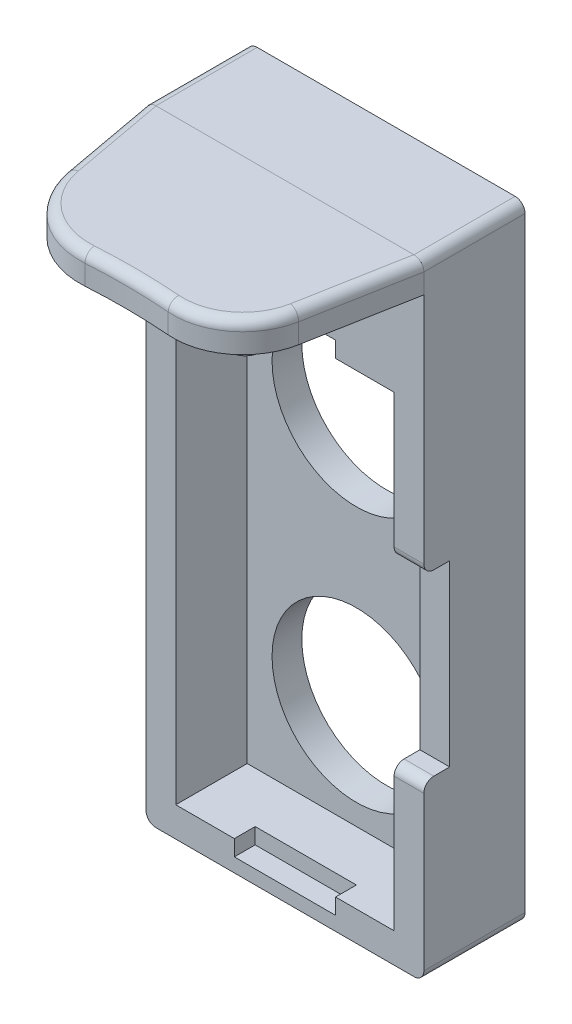
from build123d import *

# Parameters (mm, degrees)
SKETCH2_W           = 28
SKETCH2_H           = 53
SKETCH2_W_2         = 22
SKETCH2_H_2         = 47
SKETCH2_R           = 8.5
BOSS_EXTRUDE1_DEPTH = 3
SKETCH3_W           = 28
SKETCH3_H           = 53
SKETCH3_W_2         = 22
SKETCH3_H_2         = 47
EXTRUDE_THIN1_DEPTH = 7.2
SKETCH4_W           = 6
SKETCH4_H           = 18
CUT_EXTRUDE1_DEPTH  = 2.6
SKETCH5_W           = 10.2
SKETCH5_H           = 1.6
CUT_EXTRUDE2_DEPTH  = 2.1
SKETCH6_W           = 28
SKETCH6_H           = 10.2
BOSS_EXTRUDE2_DEPTH = 10
SKETCH7_R           = 1.5875
BOSS_EXTRUDE3_DEPTH = 3
SKETCH8_R           = 1.5875
BOSS_EXTRUDE4_DEPTH = 3.2
FILLET1_R           = 8
FILLET2_R           = 7
FILLET3_R           = 1
FILLET4_R           = 1


with BuildPart() as part:
    # Sketch2 → Boss-Extrude1 (new body)
    # profile 1 of 2: a face of its own
    with BuildSketch(Plane.XY):
        Rectangle(SKETCH2_W, SKETCH2_H)
        Rectangle(SKETCH2_W_2, SKETCH2_H_2, mode=Mode.SUBTRACT)
    # profile 2 of 2: a face of its own
    with BuildSketch(Plane.XY):
        Rectangle(SKETCH2_W_2, SKETCH2_H_2)
        with Locations((0, 12.9)):
            Circle(SKETCH2_R, mode=Mode.SUBTRACT)
        with Locations((0, -12.9)):
            Circle(SKETCH2_R, mode=Mode.SUBTRACT)
    extrude(amount=BOSS_EXTRUDE1_DEPTH)

    # Sketch3 → Extrude-Thin1 (add)
    with BuildSketch(Plane.XY.offset(3)):
        Rectangle(SKETCH3_W, SKETCH3_H)
        Rectangle(SKETCH3_W_2, SKETCH3_H_2, mode=Mode.SUBTRACT)
    extrude(amount=EXTRUDE_THIN1_DEPTH)

    # Sketch4 → Cut-Extrude1 (cut)
    with BuildSketch(Plane.XY.offset(10.2)):
        with Locations((11, 0)):
            Rectangle(SKETCH4_W, SKETCH4_H)
    extrude(amount=-CUT_EXTRUDE1_DEPTH, mode=Mode.SUBTRACT)

    # Sketch5 → Cut-Extrude2 (cut)
    with BuildSketch(Plane.XY.offset(10.2)):
        with Locations((0, 24.3)):
            Rectangle(SKETCH5_W, SKETCH5_H)
        with Locations((0, -24.3)):
            Rectangle(SKETCH5_W, SKETCH5_H)
    extrude(amount=-CUT_EXTRUDE2_DEPTH, mode=Mode.SUBTRACT)

    # Sketch6 → Boss-Extrude2 (add)
    with BuildSketch(Plane(origin=(0, 26.5, 0), x_dir=(1, 0, 0), z_dir=(0, 1, 0))):
        with Locations((0, -5.1)):
            Rectangle(SKETCH6_W, SKETCH6_H)
    extrude(amount=BOSS_EXTRUDE2_DEPTH)

    # Fillet4
    fillet4_edges = [part.edges().sort_by_distance(p)[0] for p in [
        (-14, -26.5, 5.1),
        (14, -26.5, 5.1),
        (12.5, 9, 10.2),
        (12.5, -9, 10.2),
        (-14, 36.5, 5.1),
        (14, 36.5, 5.1),
    ]]
    fillet(fillet4_edges, radius=FILLET4_R)


with BuildPart() as body_2:
    # Sketch7 → Boss-Extrude3 (new body)
    # profile 1 of 11: a face of its own
    with BuildSketch(Plane(origin=(0, 36.5, 0), x_dir=(1, 0, 0), z_dir=(0, 1, 0))):
        with BuildLine():
            ThreePointArc((-13.769529259, -11.454419317), (-6.913275343, -10.514252827), (0, -10.2))
            Line((0, -10.2), (-14, -10.2))
            Line((-14, -10.2), (-13.769529259, -11.454419317))
        make_face()
    # profile 2 of 11: a face of its own
    with BuildSketch(Plane(origin=(0, 36.5, 0), x_dir=(1, 0, 0), z_dir=(0, 1, 0))):
        with BuildLine():
            Line((0, -20.2), (0, -10.2))
            ThreePointArc((0, -10.2), (-6.913275343, -10.514252827), (-13.769529259, -11.454419317))
            Line((-13.769529259, -11.454419317), (-10.842149023, -27.387731745))
            ThreePointArc((-10.842149023, -27.387731745), (-5.443523892, -26.647443171), (0, -26.4))
            Line((0, -26.4), (0, -20.2))
        make_face()
        with Locations((-6, -20.2)):
            Circle(SKETCH7_R, mode=Mode.SUBTRACT)
    # profile 3 of 11: a face of its own
    with BuildSketch(Plane(origin=(0, 36.5, 0), x_dir=(1, 0, 0), z_dir=(0, 1, 0))):
        with BuildLine():
            Line((4.4125, -20.2), (0, -20.2))
            Line((0, -20.2), (0, -26.4))
            ThreePointArc((0, -26.4), (5.443523892, -26.647443171), (10.842149023, -27.387731745))
            Line((10.842149023, -27.387731745), (13.769529259, -11.454419317))
            ThreePointArc((13.769529259, -11.454419317), (9.89785669, -10.845566424), (6, -10.436587754))
            Line((6, -10.436587754), (6, -18.6125))
            ThreePointArc((6, -18.6125), (7.122532015, -19.077467985), (7.5875, -20.2))
            ThreePointArc((7.5875, -20.2), (6, -21.7875), (4.4125, -20.2))
        make_face()
    # profile 4 of 11: a face of its own
    with BuildSketch(Plane(origin=(0, 36.5, 0), x_dir=(1, 0, 0), z_dir=(0, 1, 0))):
        with BuildLine():
            Line((14, -10.2), (6, -10.2))
            Line((6, -10.2), (6, -10.436587754))
            ThreePointArc((6, -10.436587754), (9.89785669, -10.845566424), (13.769529259, -11.454419317))
            Line((13.769529259, -11.454419317), (14, -10.2))
        make_face()
    # profile 5 of 11: a face of its own
    with BuildSketch(Plane(origin=(0, 36.5, 0), x_dir=(1, 0, 0), z_dir=(0, 1, 0))):
        with BuildLine():
            ThreePointArc((6, -10.436587754), (3.002331334, -10.259169912), (0, -10.2))
            Line((0, -10.2), (0, -20.2))
            Line((0, -20.2), (4.4125, -20.2))
            ThreePointArc((4.4125, -20.2), (4.877467985, -19.077467985), (6, -18.6125))
            Line((6, -18.6125), (6, -10.436587754))
        make_face()
    # profile 6 of 11: a face of its own
    with BuildSketch(Plane(origin=(0, 36.5, 0), x_dir=(1, 0, 0), z_dir=(0, 1, 0))):
        with Locations((-6, -20.2)):
            Circle(SKETCH7_R)
    # profile 7 of 11: a face of its own
    with BuildSketch(Plane(origin=(0, 36.5, 0), x_dir=(1, 0, 0), z_dir=(0, 1, 0))):
        with BuildLine():
            ThreePointArc((6, -18.6125), (4.877467985, -19.077467985), (4.4125, -20.2))
            Line((4.4125, -20.2), (6, -20.2))
            Line((6, -20.2), (6, -18.6125))
        make_face()
    # profile 8 of 11: a face of its own
    with BuildSketch(Plane(origin=(0, 36.5, 0), x_dir=(1, 0, 0), z_dir=(0, 1, 0))):
        with BuildLine():
            Line((6, -20.2), (4.4125, -20.2))
            ThreePointArc((4.4125, -20.2), (6, -21.7875), (7.5875, -20.2))
            ThreePointArc((7.5875, -20.2), (7.122532015, -19.077467985), (6, -18.6125))
            Line((6, -18.6125), (6, -20.2))
        make_face()
    # profile 9 of 11: a face of its own
    with BuildSketch(Plane(origin=(0, 36.5, 0), x_dir=(1, 0, 0), z_dir=(0, 1, 0))):
        with BuildLine():
            ThreePointArc((6, -18.6125), (4.877467985, -19.077467985), (4.4125, -20.2))
            Line((4.4125, -20.2), (6, -20.2))
            Line((6, -20.2), (6, -18.6125))
        make_face()
    # profile 10 of 11: a face of its own
    with BuildSketch(Plane(origin=(0, 36.5, 0), x_dir=(1, 0, 0), z_dir=(0, 1, 0))):
        with BuildLine():
            Line((6, -20.2), (4.4125, -20.2))
            ThreePointArc((4.4125, -20.2), (6, -21.7875), (7.5875, -20.2))
            ThreePointArc((7.5875, -20.2), (7.122532015, -19.077467985), (6, -18.6125))
            Line((6, -18.6125), (6, -20.2))
        make_face()
    # profile 11 of 11: a face of its own
    with BuildSketch(Plane(origin=(0, 36.5, 0), x_dir=(1, 0, 0), z_dir=(0, 1, 0))):
        with BuildLine():
            Line((6, -10.2), (0, -10.2))
            ThreePointArc((0, -10.2), (3.002331334, -10.259169912), (6, -10.436587754))
            Line((6, -10.436587754), (6, -10.2))
        make_face()
    extrude(amount=-BOSS_EXTRUDE3_DEPTH)

    # Sketch8 → Boss-Extrude4 (add)
    with BuildSketch(Plane.XZ.offset(-33.5)):
        with Locations(Location((-6, 20.2, 0), (0, 0, 90))):
            Circle(SKETCH8_R)
        with BuildLine():
            ThreePointArc((4.4125, 20.2), (4.877467985, 19.077467985), (6, 18.6125))
            Line((6, 18.6125), (6, 20.2))
            Line((6, 20.2), (4.4125, 20.2))
        make_face()
        with BuildLine():
            Line((6, 20.2), (6, 18.6125))
            ThreePointArc((6, 18.6125), (7.122532015, 19.077467985), (7.5875, 20.2))
            ThreePointArc((7.5875, 20.2), (6, 21.7875), (4.4125, 20.2))
            Line((4.4125, 20.2), (6, 20.2))
        make_face()
        with BuildLine():
            ThreePointArc((4.4125, 20.2), (4.877467985, 19.077467985), (6, 18.6125))
            Line((6, 18.6125), (6, 20.2))
            Line((6, 20.2), (4.4125, 20.2))
        make_face()
        with BuildLine():
            Line((6, 20.2), (6, 18.6125))
            ThreePointArc((6, 18.6125), (7.122532015, 19.077467985), (7.5875, 20.2))
            ThreePointArc((7.5875, 20.2), (6, 21.7875), (4.4125, 20.2))
            Line((4.4125, 20.2), (6, 20.2))
        make_face()
    extrude(amount=BOSS_EXTRUDE4_DEPTH)

    # Fillet1
    fillet1_edges = [body_2.edges().sort_by_distance(p)[0] for p in [
        (-10.842149023, 35, 27.387731745),
    ]]
    fillet(fillet1_edges, radius=FILLET1_R)

    # Fillet2
    fillet2_edges = [body_2.edges().sort_by_distance(p)[0] for p in [
        (10.842149023, 35, 27.387731745),
    ]]
    fillet(fillet2_edges, radius=FILLET2_R)

    # Fillet3
    fillet3_edges = [body_2.edges().sort_by_distance(p)[0] for p in [
        (-9.255846997, 36.5, 24.845143696),
        (0.397542937, 36.5, 26.401317018),
        (13.020403663, 36.5, 15.531802922),
        (9.425883158, 36.5, 25.145621163),
        (-13.101218066, 36.5, 15.091941669),
    ]]
    fillet(fillet3_edges, radius=FILLET3_R)


solid = Compound([part.part, body_2.part])
